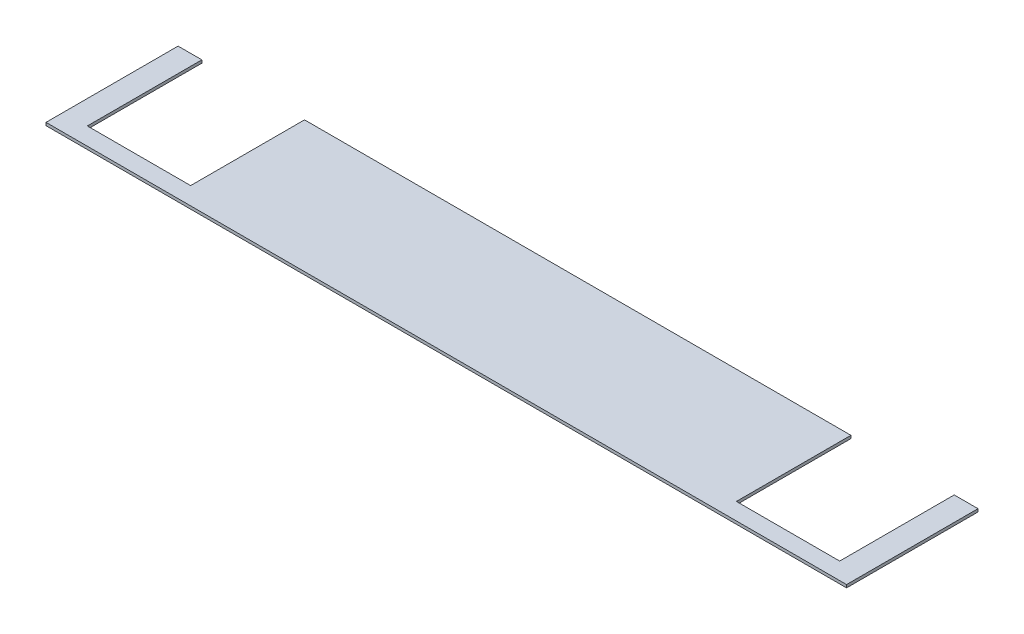
from build123d import *

# Parameters (mm, degrees)
BOSS_EXTRUDE1_DEPTH = 2.54


with BuildPart() as part:
    # Sketch1 → Boss-Extrude1 (new body)
    with BuildSketch(Plane(origin=(0, 0, 0), x_dir=(1, 0, 0), z_dir=(0, 1, 0))):
        Polygon((-245.520337503, 0), (454.479662497, 0), (454.479662497, 114.93), (433.679662497, 114.93), (433.679662497, 14.79), (343.359662497, 14.79), (343.359662497, 114.93), (-134.400337503, 114.93), (-134.400337503, 15.351235413), (-224.720337503, 15.351235413), (-224.720337503, 115.491235413), (-245.520337503, 115.491235413), align=None)
    extrude(amount=BOSS_EXTRUDE1_DEPTH)


solid = part.part
